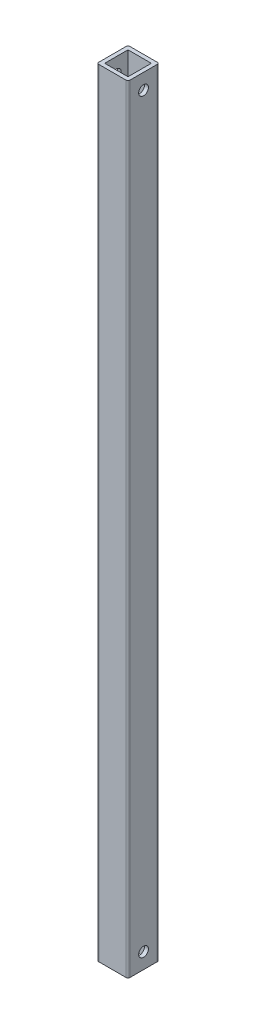
from build123d import *

# Parameters (mm, degrees)
SKETCH1_W           = 16
SKETCH1_H           = 16
SKETCH1_W_2         = 12
SKETCH1_H_2         = 12
BOSS_EXTRUDE1_DEPTH = 400
FILLET2_R           = 1
SKETCH2_R           = 2.5
CUT_EXTRUDE1_DEPTH  = 16


with BuildPart() as part:
    # Sketch1 → Boss-Extrude1 (new body)
    with BuildSketch(Plane(origin=(0, 0, 0), x_dir=(1, 0, 0), z_dir=(0, 1, 0))):
        with Locations((4.851851852, 0.925925926)):
            Rectangle(SKETCH1_W, SKETCH1_H)
        with Locations((4.851851852, 0.925925926)):
            Rectangle(SKETCH1_W_2, SKETCH1_H_2, mode=Mode.SUBTRACT)
    extrude(amount=BOSS_EXTRUDE1_DEPTH)

    # Fillet2
    fillet2_edges = [part.edges().sort_by_distance(p)[0] for p in [
        (-3.148148148, 200, -8.925925926),
        (12.851851852, 200, -8.925925926),
        (12.851851852, 200, 7.074074074),
        (-3.148148148, 200, 7.074074074),
    ]]
    fillet(fillet2_edges, radius=FILLET2_R)

    # Sketch2 → Cut-Extrude1 (cut)
    with BuildSketch(Plane.ZY.offset(3.148148148)):
        with Locations((-0.925925926, 8)):
            Circle(SKETCH2_R)
        with Locations((-0.925925926, 392)):
            Circle(SKETCH2_R)
    extrude(amount=-CUT_EXTRUDE1_DEPTH, mode=Mode.SUBTRACT)


solid = part.part
